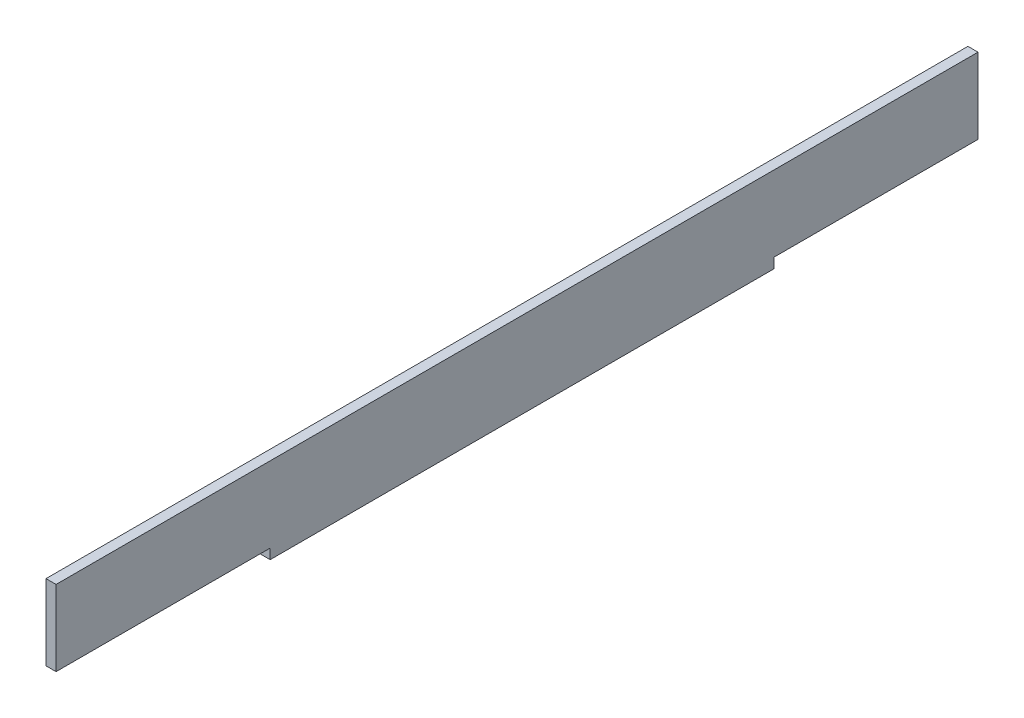
from build123d import *

# Parameters (mm, degrees)
BOSS_EXTRUDE1_DEPTH = 4


with BuildPart() as part:
    # Sketch1 → Boss-Extrude1 (new body)
    with BuildSketch(Plane(origin=(0, 0, 0), x_dir=(0, 0, -1), z_dir=(1, 0, 0))):
        Polygon((-97.273917249, -16.909239656), (102.726082751, -16.909239656), (102.726082751, -12.909239656), (183.726082751, -12.909239656), (183.726082751, 17.090760344), (102.726082751, 17.090760344), (-97.273917249, 17.090760344), (-182.273917249, 17.090760344), (-182.273917249, -12.909239656), (-97.273917249, -12.909239656), align=None)
    extrude(amount=BOSS_EXTRUDE1_DEPTH)


solid = part.part
